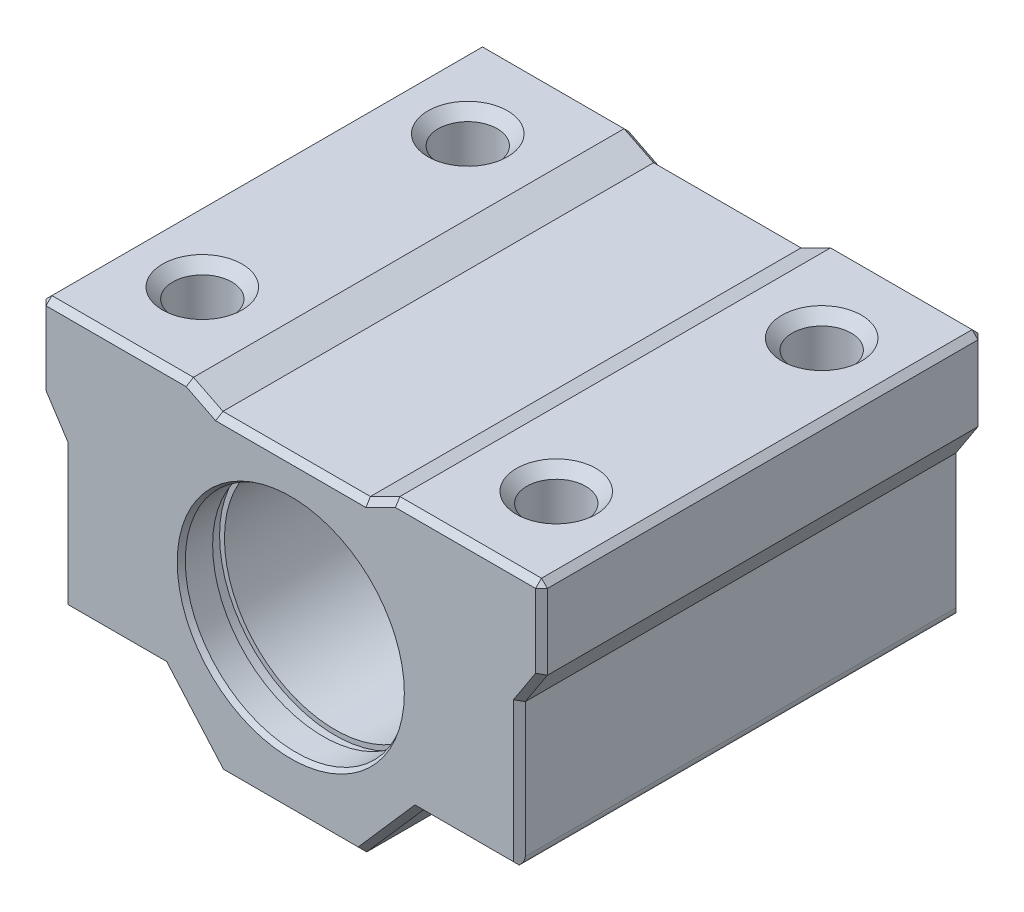
from build123d import *
from OCP.BRepFilletAPI import BRepFilletAPI_MakeChamfer

# Parameters (mm, degrees)
SKETCH1_R             = 7.5
BOSS_EXTRUDE1_DEPTH   = 15
CHAFL_N0_SIZE         = 0.2
CHAFL_N0_SIZE2        = 0.346410162
CROQUIS1_R            = 2
CORTAR_EXTRUIR1_DEPTH = 20
CHAFL_N1_SIZE         = 0.7
CHAFL_N2_SIZE         = 0.4
REDONDEO1_R           = 0.7
SKETCH2_R             = 7.83
CUT_EXTRUDE1_DEPTH    = 0.8


with BuildPart() as part:
    # Sketch1 → Boss-Extrude1 (new, symmetric)
    with BuildSketch(Plane.XY):
        Polygon((-5, -1), (5, -1), (7, 0), (17, 0), (17, -5.5), (15.5, -7.8), (15.5, -17.6), (8.6, -17.6), (4.75, -22), (-4.75, -22), (-8.6, -17.6), (-15.5, -17.6), (-15.5, -7.8), (-17, -5.5), (-17, 0), (-7, 0), align=None)
        with Locations((0, -11)):
            Circle(SKETCH1_R, mode=Mode.SUBTRACT)
    extrude(amount=BOSS_EXTRUDE1_DEPTH, both=True)

    # Chaflàn0: one chamfer whose edges measure the first distance from different faces: ONE call of the kernel's chamfer builder (chamfer() names one face for all edges)
    chafl_n0_edges_1 = [part.edges().sort_by_distance(p)[0] for p in [
        (-7.5, -11, -15),
    ]]
    chafl_n0_side_1 = [part.faces().sort_by_distance(p)[0] for p in [
        (-7.5, -11, 0),
    ]]
    chafl_n0_edges_2 = [part.edges().sort_by_distance(p)[0] for p in [
        (-7.5, -11, 15),
    ]]
    chafl_n0_side_2 = [part.faces().sort_by_distance(p)[0] for p in [
        (0, -1.404969135, 15),
    ]]
    chafl_n0 = BRepFilletAPI_MakeChamfer(part.part.solid().wrapped)
    for e in chafl_n0_edges_1:
        chafl_n0.Add(CHAFL_N0_SIZE, CHAFL_N0_SIZE2, e.wrapped, chafl_n0_side_1[0].wrapped)  # the first distance lies on this face
    for e in chafl_n0_edges_2:
        chafl_n0.Add(CHAFL_N0_SIZE, CHAFL_N0_SIZE2, e.wrapped, chafl_n0_side_2[0].wrapped)  # the first distance lies on this face
    add(Compound.cast(chafl_n0.Shape()), mode=Mode.REPLACE)

    # Croquis1 → Cortar-Extruir1 (cut)
    with BuildSketch(Plane(origin=(0, 0, 0), x_dir=(1, 0, 0), z_dir=(0, 1, 0))):
        with Locations(Location((-12, 9, 0), (0, 0, 180))):
            Circle(CROQUIS1_R)
        with Locations(Location((12, 9, 0), (0, 0, 180))):
            Circle(CROQUIS1_R)
        with Locations(Location((-12, -9, 0), (0, 0, 180))):
            Circle(CROQUIS1_R)
        with Locations(Location((12, -9, 0), (0, 0, 180))):
            Circle(CROQUIS1_R)
    extrude(amount=-CORTAR_EXTRUIR1_DEPTH, mode=Mode.SUBTRACT)

    # Chaflán1
    chafl_n1_edges = [part.edges().sort_by_distance(p)[0] for p in [
        (-10, -17.6, -9),
        (-10, 0, -9),
        (14, -17.6, -9),
        (14, 0, -9),
        (-10, -17.6, 9),
        (-10, 0, 9),
        (14, -17.6, 9),
        (14, 0, 9),
    ]]
    chamfer(chafl_n1_edges, length=CHAFL_N1_SIZE)

    # Chaflán2
    chafl_n2_edges = [part.edges().sort_by_distance(p)[0] for p in [
        (-6, -0.5, 15),
        (-12, 0, 15),
        (12, 0, -15),
        (17, -2.75, -15),
        (16.25, -6.65, -15),
        (15.5, -12.7, -15),
        (12.05, -17.6, -15),
        (-17, -2.75, 15),
        (6.675, -19.8, -15),
        (0, -22, -15),
        (-6.675, -19.8, -15),
        (-12.05, -17.6, -15),
        (-15.5, -12.7, -15),
        (-16.25, -6.65, -15),
        (-17, -2.75, -15),
        (-12, 0, -15),
        (-16.25, -6.65, 15),
        (-6, -0.5, -15),
        (0, -1, -15),
        (6, -0.5, -15),
        (-15.5, -12.7, 15),
        (-12.05, -17.6, 15),
        (17, 0, 0),
        (-17, 0, 0),
        (-6.675, -19.8, 15),
        (0, -22, 15),
        (6.675, -19.8, 15),
        (12.05, -17.6, 15),
        (6, -0.5, 15),
        (15.5, -12.7, 15),
        (16.25, -6.65, 15),
        (17, -2.75, 15),
        (12, 0, 15),
        (0, -1, 15),
    ]]
    chamfer(chafl_n2_edges, length=CHAFL_N2_SIZE)

    # Redondeo1
    redondeo1_edges = [part.edges().sort_by_distance(p)[0] for p in [
        (15.5, -17.6, 0),
        (-15.5, -17.6, 0),
    ]]
    fillet(redondeo1_edges, radius=REDONDEO1_R)

    # Sketch2 → Cut-Extrude1 (cut)
    with BuildSketch(Plane.XY.offset(12.8)):
        with Locations((0, -11)):
            Circle(SKETCH2_R)
    cut_extrude1 = extrude(amount=-CUT_EXTRUDE1_DEPTH, mode=Mode.SUBTRACT)

    # Mirror1: Cut-Extrude1 across plane
    add(cut_extrude1.mirror(Plane.XY), mode=Mode.SUBTRACT)


solid = part.part
